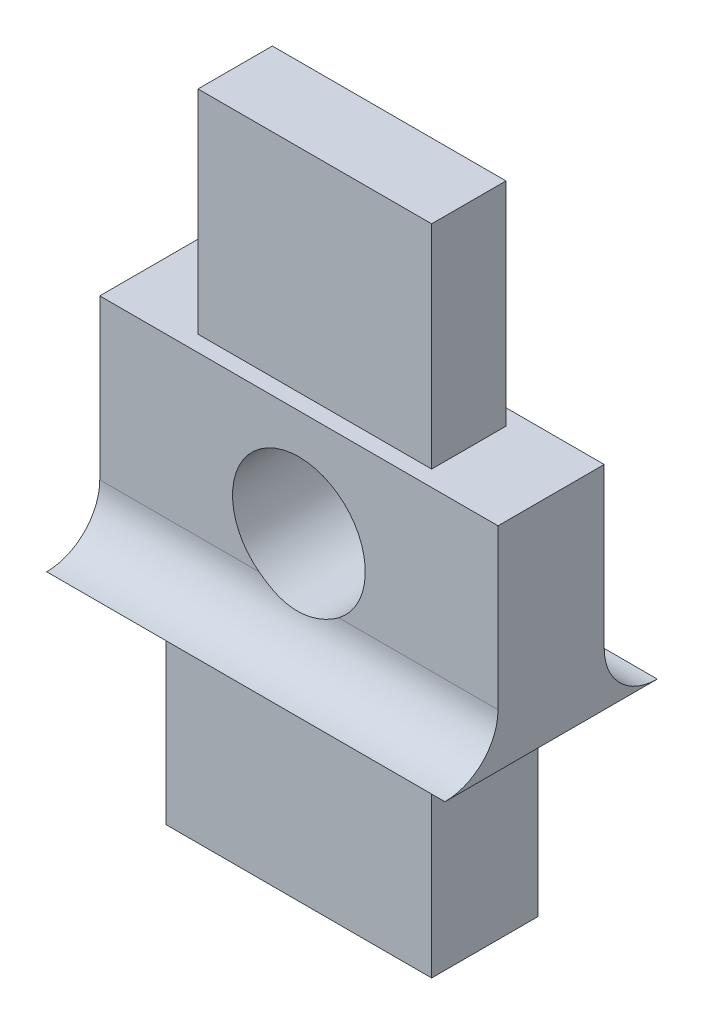
from build123d import *

# Parameters (mm, degrees)
SKETCH1_R               = 1.25
BOSS_EXTRUDE1_DEPTH     = 2
BOSS_EXTRUDE2_REACH     = 1468.905
CUT_EXTRUDE1_DEPTH      = 2447.874245797
CUT_EXTRUDE1_DEPTH_BACK = 2447.874245797
SKETCH3_R               = 1.25
SKETCH4_W               = 5
SKETCH4_H               = 2
SKETCH4_W_2             = 4.4
SKETCH4_H_2             = 1.4
CUT_EXTRUDE2_DEPTH      = 4


with BuildPart() as part:
    # Sketch1 → Boss-Extrude1 (new body)
    with BuildSketch(Plane.XY):
        Polygon((1952.176808721, 1466.884115951), (1957.176808721, 1466.884115951), (1957.176808721, 1462.884115951), (1958.426808721, 1462.884115951), (1958.426808721, 1458.884115951), (1957.176808721, 1458.884115951), (1957.176808721, 1454.884115951), (1952.176808721, 1454.884115951), (1952.176808721, 1458.884115951), (1950.926808721, 1458.884115951), (1950.926808721, 1462.884115951), (1952.176808721, 1462.884115951), align=None)
        with Locations((1954.676808721, 1460.884115951)):
            Circle(SKETCH1_R, mode=Mode.SUBTRACT)
    extrude(amount=BOSS_EXTRUDE1_DEPTH)

    # Boss-Extrude2: up to this face of the body (flat: up to its plane)
    boss_extrude2_end = Plane(part.part.faces().sort_by_distance((1958.426808721, 1460.884115951, 1))[0])
    # Sketch2 → Boss-Extrude2 (add, up to the picked face)
    with BuildSketch(Plane.ZY.offset(-1950.926808721), mode=Mode.PRIVATE) as boss_extrude2_sk1:
        with BuildLine():
            Line((2, 1458.884115951), (2, 1459.884115951))
            ThreePointArc((2, 1459.884115951), (2.292893219, 1459.17700917), (3, 1458.884115951))
            Line((3, 1458.884115951), (2, 1458.884115951))
        make_face()
    boss_extrude2_tool1 = split(extrude(boss_extrude2_sk1.sketch, amount=-BOSS_EXTRUDE2_REACH, mode=Mode.PRIVATE), bisect_by=boss_extrude2_end, keep=Keep.BOTH, mode=Mode.PRIVATE)
    # Sketch2 → Boss-Extrude2 (add, up to the picked face)
    with BuildSketch(Plane.ZY.offset(-1950.926808721), mode=Mode.PRIVATE) as boss_extrude2_sk2:
        with BuildLine():
            Line((0, 1458.884115951), (-1, 1458.884115951))
            ThreePointArc((-1, 1458.884115951), (-0.292893219, 1459.17700917), (0, 1459.884115951))
            Line((0, 1459.884115951), (0, 1458.884115951))
        make_face()
    boss_extrude2_tool2 = split(extrude(boss_extrude2_sk2.sketch, amount=-BOSS_EXTRUDE2_REACH, mode=Mode.PRIVATE), bisect_by=boss_extrude2_end, keep=Keep.BOTH, mode=Mode.PRIVATE)
    add(boss_extrude2_tool1.solids().sort_by(Axis((1950.926809, 1459.107484, 2.223368), (1, 0, 0)))[0])
    add(boss_extrude2_tool2.solids().sort_by(Axis((1950.926809, 1459.107484, -0.223368), (1, 0, 0)))[0])

    # Sketch3 → Cut-Extrude1 (cut, two sides: drawn at the far end of the back side and taken through both)
    with BuildSketch(Plane.XY.offset(2).offset(-CUT_EXTRUDE1_DEPTH_BACK)):
        with Locations(Location((1954.676808721, 1460.884115951, 0), (0, 0, 233.130102355))):
            Circle(SKETCH3_R)
    extrude(amount=CUT_EXTRUDE1_DEPTH + CUT_EXTRUDE1_DEPTH_BACK, mode=Mode.SUBTRACT)

    # Sketch4 → Cut-Extrude2 (cut)
    with BuildSketch(Plane(origin=(0, 1466.884115951, 0), x_dir=(1, 0, 0), z_dir=(0, 1, 0))):
        with Locations((1954.676808721, -1)):
            Rectangle(SKETCH4_W, SKETCH4_H)
        with Locations((1954.676808721, -1)):
            Rectangle(SKETCH4_W_2, SKETCH4_H_2, mode=Mode.SUBTRACT)
    extrude(amount=-CUT_EXTRUDE2_DEPTH, mode=Mode.SUBTRACT)


solid = part.part
